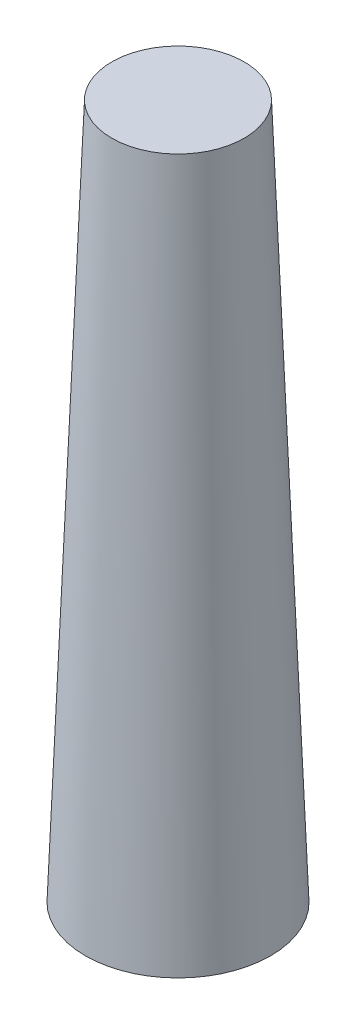
from build123d import *

# Parameters (mm, degrees)
SKETCH2_R = 3.628571429
SKETCH1_R = 5.08


with BuildPart() as part:
    # Sketch2 → Loft1 section 0
    with BuildSketch(Plane(origin=(0, 38.1, 0), x_dir=(1, 0, 0), z_dir=(0, 1, 0))):
        Circle(SKETCH2_R)
    # Sketch1 → Loft1 section 1
    with BuildSketch(Plane(origin=(0, 0, 0), x_dir=(1, 0, 0), z_dir=(0, 1, 0))):
        Circle(SKETCH1_R)
    loft()


solid = part.part
